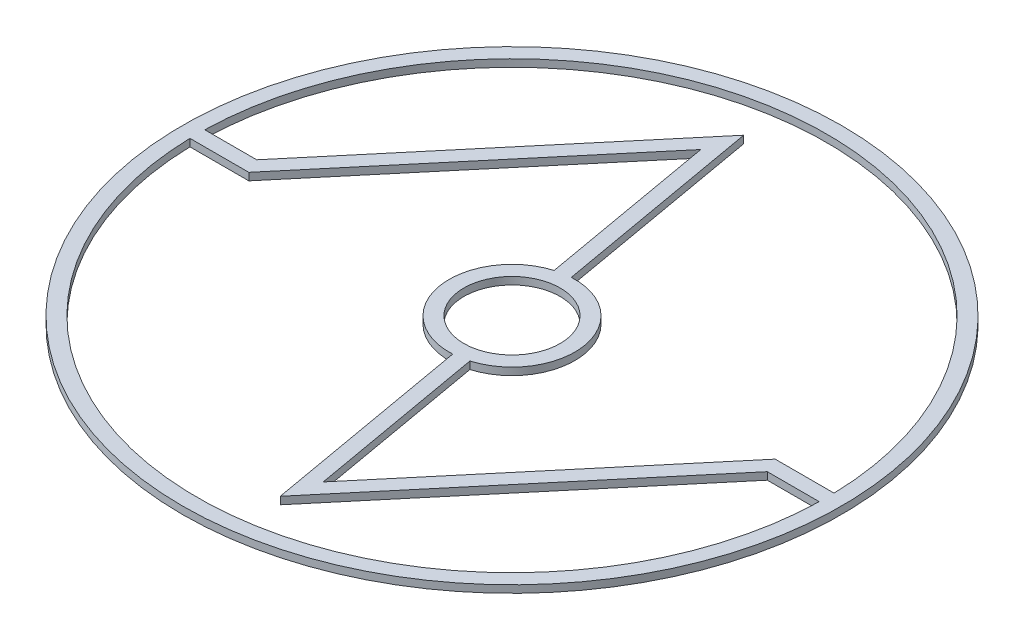
from build123d import *

# Parameters (mm, degrees)
SKETCH_1_R      = 44.5
SKETCH_1_R_2    = 42.5
EXTRUDE_7_DEPTH = 1


with BuildPart() as part:
    # Эскиз1 → Бобышка-Вытянуть7 (new body)
    # profile 1 of 9: a face of its own
    with BuildSketch(Plane(origin=(0, 0, 0), x_dir=(1, 0, 0), z_dir=(0, 1, 0))):
        with Locations(Location((0, 0, 0), (0, 0, 270))):
            Circle(SKETCH_1_R)
        Circle(SKETCH_1_R_2, mode=Mode.SUBTRACT)
    # profile 2 of 9: a face of its own
    with BuildSketch(Plane(origin=(0, 0, 0), x_dir=(1, 0, 0), z_dir=(0, 1, 0))):
        with BuildLine():
            Line((-35.470093763, 1), (-42.488233665, 1))
            ThreePointArc((-42.488233665, 1), (-42.5, 0), (-42.488233665, -1))
            Line((-42.488233665, -1), (-34.537478446, -1))
            Line((-34.537478446, -1), (-6.690761703, 32.186424721))
            Line((-6.690761703, 32.186424721), (-2.450567073, 8.139086006))
            ThreePointArc((-2.450567073, 8.139086006), (-1.47600951, 8.370865901), (-0.480951567, 8.486382362))
            Line((-0.480951567, 8.486382362), (-5.465925634, 36.75757516))
            Line((-5.465925634, 36.75757516), (-35.470093763, 1))
        make_face()
    # profile 3 of 9: a face of its own
    with BuildSketch(Plane(origin=(0, 0, 0), x_dir=(1, 0, 0), z_dir=(0, 1, 0))):
        with BuildLine():
            ThreePointArc((8.5, 0), (5.837889673, 6.17811008), (-0.480951567, 8.486382362))
            Line((-0.480951567, 8.486382362), (-0.130467861, 6.498690494))
            ThreePointArc((-0.130467861, 6.498690494), (4.549832904, 4.64209226), (6.5, 0))
            ThreePointArc((6.5, 0), (5.28680158, -3.781498255), (2.100083368, -6.151394139))
            Line((2.100083368, -6.151394139), (2.450567073, -8.139086006))
            ThreePointArc((2.450567073, -8.139086006), (6.822016568, -5.070511802), (8.5, 0))
        make_face()
    # profile 4 of 9: a face of its own
    with BuildSketch(Plane(origin=(0, 0, 0), x_dir=(1, 0, 0), z_dir=(0, 1, 0))):
        with BuildLine():
            Line((-0.130467861, 6.498690494), (-0.480951567, 8.486382362))
            ThreePointArc((-0.480951567, 8.486382362), (-1.47600951, 8.370865901), (-2.450567073, 8.139086006))
            Line((-2.450567073, 8.139086006), (-2.100083368, 6.151394139))
            ThreePointArc((-2.100083368, 6.151394139), (-1.128713155, 6.401250395), (-0.130467861, 6.498690494))
        make_face()
    # profile 5 of 9: a face of its own
    with BuildSketch(Plane(origin=(0, 0, 0), x_dir=(1, 0, 0), z_dir=(0, 1, 0))):
        with BuildLine():
            ThreePointArc((0.480951567, -8.486382362), (1.47600951, -8.370865901), (2.450567073, -8.139086006))
            Line((2.450567073, -8.139086006), (2.100083368, -6.151394139))
            ThreePointArc((2.100083368, -6.151394139), (1.128713155, -6.401250395), (0.130467861, -6.498690494))
            Line((0.130467861, -6.498690494), (0.480951567, -8.486382362))
        make_face()
    # profile 6 of 9: a face of its own
    with BuildSketch(Plane(origin=(0, 0, 0), x_dir=(1, 0, 0), z_dir=(0, 1, 0))):
        with BuildLine():
            Line((-2.100083368, 6.151394139), (-2.450567073, 8.139086006))
            ThreePointArc((-2.450567073, 8.139086006), (-8.370865901, -1.47600951), (0.480951567, -8.486382362))
            Line((0.480951567, -8.486382362), (0.130467861, -6.498690494))
            ThreePointArc((0.130467861, -6.498690494), (-6.401250395, -1.128713155), (-2.100083368, 6.151394139))
        make_face()
    # profile 7 of 9: a face of its own
    with BuildSketch(Plane(origin=(0, 0, 0), x_dir=(1, 0, 0), z_dir=(0, 1, 0))):
        with BuildLine():
            ThreePointArc((42.5, 0), (42.497058315, 0.50003461), (42.488233665, 1))
            Line((42.488233665, 1), (34.537478446, 1))
            Line((34.537478446, 1), (6.690761703, -32.186424721))
            Line((6.690761703, -32.186424721), (2.450567073, -8.139086006))
            ThreePointArc((2.450567073, -8.139086006), (1.47600951, -8.370865901), (0.480951567, -8.486382362))
            Line((0.480951567, -8.486382362), (5.465925634, -36.75757516))
            Line((5.465925634, -36.75757516), (35.470093763, -1))
            Line((35.470093763, -1), (42.488233665, -1))
            ThreePointArc((42.488233665, -1), (42.497058315, -0.50003461), (42.5, 0))
        make_face()
    # profile 8 of 9: a face of its own
    with BuildSketch(Plane(origin=(0, 0, 0), x_dir=(1, 0, 0), z_dir=(0, 1, 0))):
        with BuildLine():
            Line((-0.130467861, 6.498690494), (-0.480951567, 8.486382362))
            ThreePointArc((-0.480951567, 8.486382362), (-1.47600951, 8.370865901), (-2.450567073, 8.139086006))
            Line((-2.450567073, 8.139086006), (-2.100083368, 6.151394139))
            ThreePointArc((-2.100083368, 6.151394139), (-1.128713155, 6.401250395), (-0.130467861, 6.498690494))
        make_face()
    # profile 9 of 9: a face of its own
    with BuildSketch(Plane(origin=(0, 0, 0), x_dir=(1, 0, 0), z_dir=(0, 1, 0))):
        with BuildLine():
            ThreePointArc((0.480951567, -8.486382362), (1.47600951, -8.370865901), (2.450567073, -8.139086006))
            Line((2.450567073, -8.139086006), (2.100083368, -6.151394139))
            ThreePointArc((2.100083368, -6.151394139), (1.128713155, -6.401250395), (0.130467861, -6.498690494))
            Line((0.130467861, -6.498690494), (0.480951567, -8.486382362))
        make_face()
    extrude(amount=EXTRUDE_7_DEPTH)


solid = part.part
